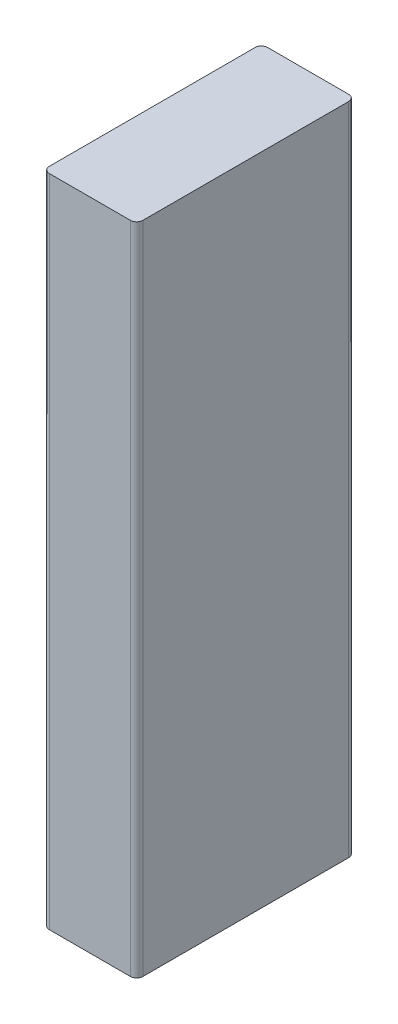
from build123d import *

# Parameters (mm, degrees)
SKETCH1_W           = 38.1
SKETCH1_H           = 88.9
BOSS_EXTRUDE1_DEPTH = 266.7
FILLET1_R           = 2.54


with BuildPart() as part:
    # Sketch1 → Boss-Extrude1 (new body)
    with BuildSketch(Plane(origin=(0, 0, 0), x_dir=(1, 0, 0), z_dir=(0, 1, 0))):
        Rectangle(SKETCH1_W, SKETCH1_H)
    extrude(amount=BOSS_EXTRUDE1_DEPTH)

    # Fillet1
    fillet1_edges = [part.edges().sort_by_distance(p)[0] for p in [
        (19.05, 133.35, 44.45),
        (-19.05, 133.35, 44.45),
        (-19.05, 133.35, -44.45),
        (19.05, 133.35, -44.45),
    ]]
    fillet(fillet1_edges, radius=FILLET1_R)


solid = part.part
